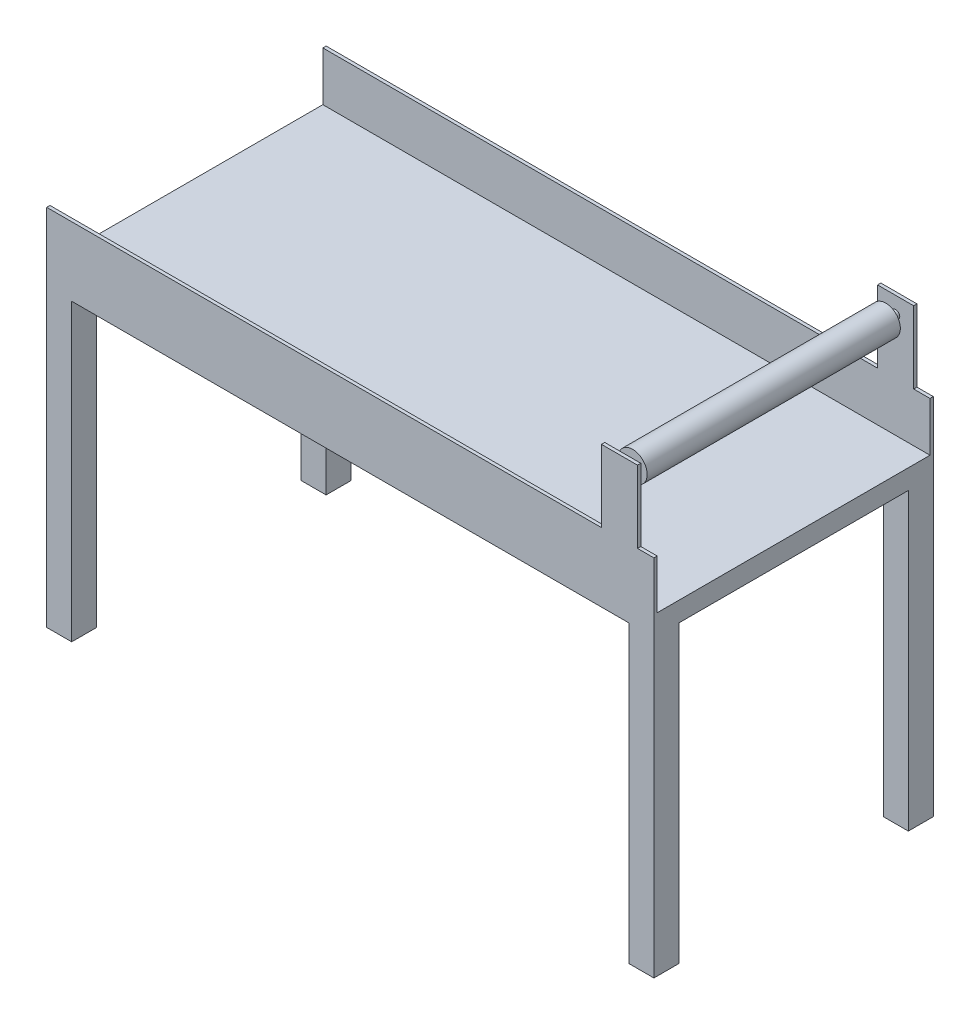
from build123d import *

# Parameters (mm, degrees)
CROQUIS2_W                = 76.2
CROQUIS2_H                = 76.2
SALIENTE_EXTRUIR1_DEPTH   = 900
SALIENTE_EXTRUIR1_2_DEPTH = 900
SALIENTE_EXTRUIR1_3_DEPTH = 900
SALIENTE_EXTRUIR1_4_DEPTH = 900
CROQUIS3_W                = 1852.4
CROQUIS3_H                = 852.4
SALIENTE_EXTRUIR2_DEPTH   = 210
CROQUIS4_W                = 832.4
CROQUIS4_H                = 150
CORTAR_EXTRUIR1_DEPTH     = 1852.4
CROQUIS5_W                = 110
CROQUIS5_H                = 10
SALIENTE_EXTRUIR3_DEPTH   = 220
CROQUIS6_R                = 12.7
SALIENTE_EXTRUIR4_DEPTH   = 40
SALIENTE_EXTRUIR5_START   = -40
CROQUIS7_R                = 12.7
SALIENTE_EXTRUIR5_DEPTH   = 40
CROQUIS8_R                = 44.45
SALIENTE_EXTRUIR6_DEPTH   = 772.4


with BuildPart() as part:
    # Croquis2 → Saliente-Extruir1 (new body)
    with BuildSketch(Plane(origin=(0, 0, 0), x_dir=(1, 0, 0), z_dir=(0, 1, 0))):
        with Locations((38.1, -38.1)):
            Rectangle(CROQUIS2_W, CROQUIS2_H)
    extrude(amount=SALIENTE_EXTRUIR1_DEPTH)



with BuildPart() as body_2:
    # Croquis2 → Saliente-Extruir1 2 (new body)
    with BuildSketch(Plane(origin=(0, 0, 0), x_dir=(1, 0, 0), z_dir=(0, 1, 0))):
        with Locations((1814.3, -38.1)):
            Rectangle(CROQUIS2_W, CROQUIS2_H)
    extrude(amount=SALIENTE_EXTRUIR1_2_DEPTH)


with BuildPart() as body_3:
    # Croquis2 → Saliente-Extruir1 3 (new body)
    with BuildSketch(Plane(origin=(0, 0, 0), x_dir=(1, 0, 0), z_dir=(0, 1, 0))):
        with Locations((1814.3, -814.3)):
            Rectangle(CROQUIS2_W, CROQUIS2_H)
    extrude(amount=SALIENTE_EXTRUIR1_3_DEPTH)


with BuildPart() as body_4:
    # Croquis2 → Saliente-Extruir1 4 (new body)
    with BuildSketch(Plane(origin=(0, 0, 0), x_dir=(1, 0, 0), z_dir=(0, 1, 0))):
        with Locations((38.1, -814.3)):
            Rectangle(CROQUIS2_W, CROQUIS2_H)
    extrude(amount=SALIENTE_EXTRUIR1_4_DEPTH)


with BuildPart() as part_1:
    add(part.part)

    add(body_2.part)  # Saliente-Extruir2 merges body 2

    add(body_3.part)  # Saliente-Extruir2 merges body 3

    add(body_4.part)  # Saliente-Extruir2 merges body 4
    # Croquis3 → Saliente-Extruir2 (add)
    with BuildSketch(Plane(origin=(0, 900, 0), x_dir=(1, 0, 0), z_dir=(0, 1, 0))):
        with Locations((926.2, -426.2)):
            Rectangle(CROQUIS3_W, CROQUIS3_H)
    extrude(amount=SALIENTE_EXTRUIR2_DEPTH)

    # Croquis4 → Cortar-Extruir1 (cut)
    with BuildSketch(Plane.ZY):
        with Locations((426.2, 1035)):
            Rectangle(CROQUIS4_W, CROQUIS4_H)
    extrude(amount=-CORTAR_EXTRUIR1_DEPTH, mode=Mode.SUBTRACT)

    # Croquis5 → Saliente-Extruir3 (add)
    with BuildSketch(Plane(origin=(0, 1110, 0), x_dir=(1, 0, 0), z_dir=(0, 1, 0))):
        with Locations((1747.4, -5)):
            Rectangle(CROQUIS5_W, CROQUIS5_H)
        with Locations((1747.4, -847.4)):
            Rectangle(CROQUIS5_W, CROQUIS5_H)
    extrude(amount=SALIENTE_EXTRUIR3_DEPTH)

    # Croquis6 → Saliente-Extruir4 (add)
    with BuildSketch(Plane.XY.offset(852.4)):
        with Locations((1747.4, 1280)):
            Circle(CROQUIS6_R)
    extrude(amount=-SALIENTE_EXTRUIR4_DEPTH)

    # Croquis7 → Saliente-Extruir5 (add)
    with BuildSketch(Plane(origin=(0, 0, 0), x_dir=(-1, 0, 0), z_dir=(0, 0, -1)).offset(SALIENTE_EXTRUIR5_START)):
        with Locations(Location((-1747.4, 1280, 0), (0, 0, 180))):
            Circle(CROQUIS7_R)
    extrude(amount=SALIENTE_EXTRUIR5_DEPTH)

    # Croquis8 → Saliente-Extruir6 (add)
    with BuildSketch(Plane.XY.offset(40)):
        with Locations((1747.4, 1280)):
            Circle(CROQUIS8_R)
    extrude(amount=SALIENTE_EXTRUIR6_DEPTH)


solid = part_1.part
